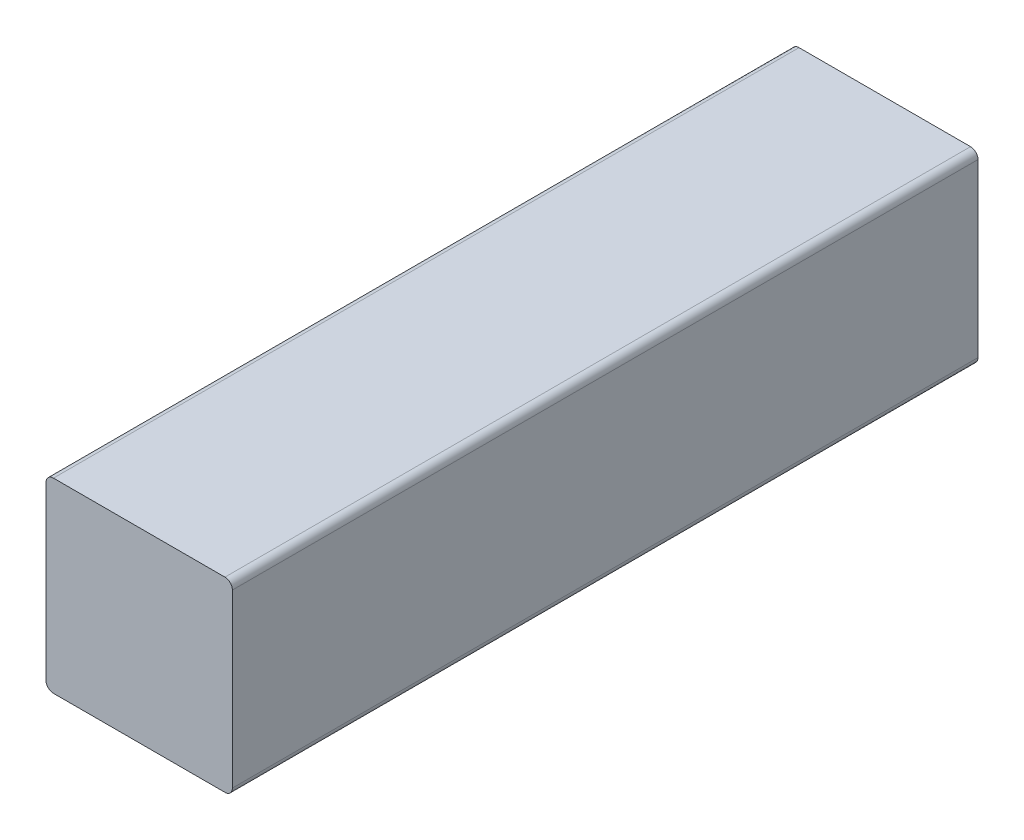
from build123d import *

# Parameters (mm, degrees)
SKETCH1_W           = 6.35
SKETCH1_H           = 6.35
BOSS_EXTRUDE1_DEPTH = 25.4
FILLET1_R           = 0.254


with BuildPart() as part:
    # Sketch1 → Boss-Extrude1 (new body)
    with BuildSketch(Plane.XY):
        with Locations((3.175, 3.175)):
            Rectangle(SKETCH1_W, SKETCH1_H)
    extrude(amount=-BOSS_EXTRUDE1_DEPTH)

    # Fillet1
    fillet1_edges = [part.edges().sort_by_distance(p)[0] for p in [
        (0, 6.35, -12.7),
        (6.35, 6.35, -12.7),
        (6.35, 0, -12.7),
        (0, 0, -12.7),
    ]]
    fillet(fillet1_edges, radius=FILLET1_R)


solid = part.part
